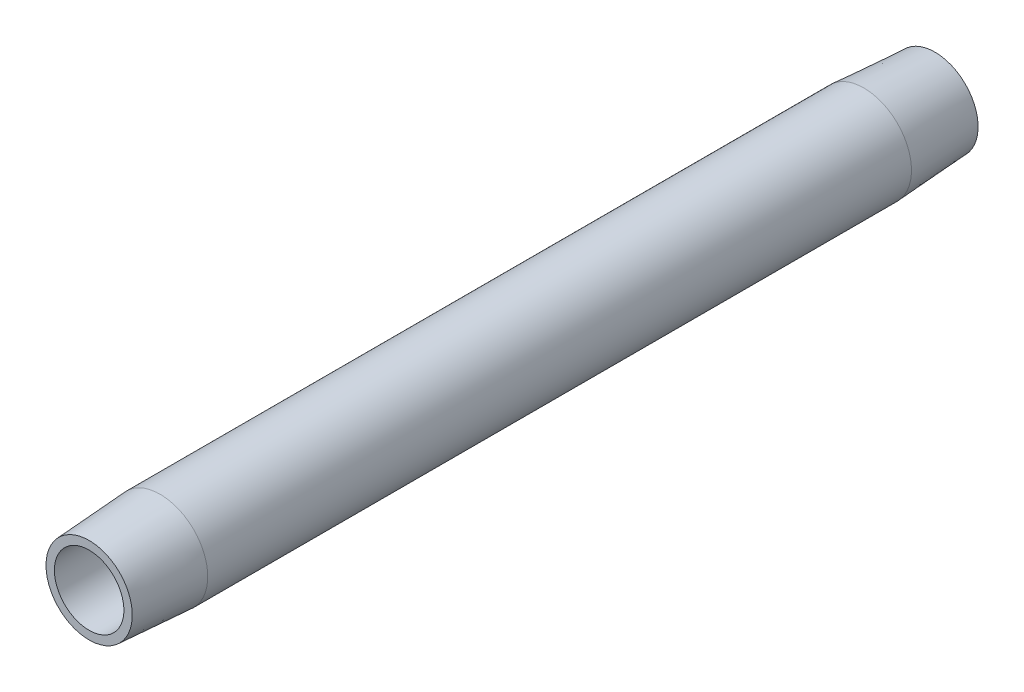
from build123d import *


with BuildPart() as part:
    # Sketch1 → Revolve1 (revolve)
    with BuildSketch(Plane.XZ, mode=Mode.PRIVATE) as revolve1_sk:
        Polygon((8.5725, -139.600432), (8.5725, -12.799568), (7.772527, 0), (6.2611, 0), (6.2611, -152.4), (7.772527, -152.4), align=None)
    revolve(revolve1_sk.sketch.rotate(Axis((0, 0, 0), (0, 0, -1)), 180), axis=Axis((0, 0, 0), (0, 0, -1)))


solid = part.part
